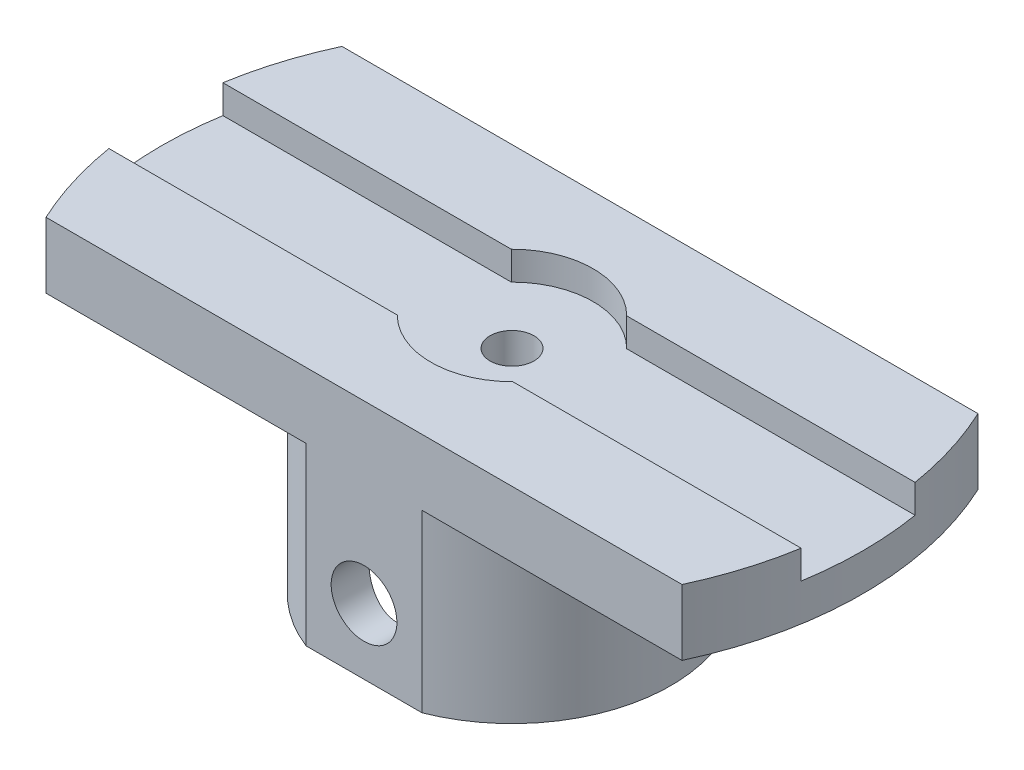
from build123d import *

# Parameters (mm, degrees)
SKETCH1_R               = 16
BOSS_EXTRUDE1_DEPTH     = 3
CUT_EXTRUDE1_START      = -1.3
CUT_EXTRUDE1_DEPTH      = 1.3
CUT_EXTRUDE3_DEPTH      = 2
CUT_EXTRUDE3_DEPTH_BACK = 2
SKETCH4_R               = 1
SKETCH5_R               = 7.25
SKETCH5_R_2             = 5.25
EXTRUDE_THIN1_DEPTH     = 8
CUT_EXTRUDE4_DEPTH      = 100
CUT_EXTRUDE4_DEPTH_BACK = 100
SKETCH6_W               = 10.574311585
SKETCH6_H               = 20.455042326
SKETCH6_W_2             = 9.477353479
SKETCH6_H_2             = 21.35841959
SKETCH7_R               = 1.5
CUT_EXTRUDE5_DEPTH      = 30
SKETCH8_R               = 3.7
CUT_EXTRUDE6_DEPTH      = 1.3


with BuildPart() as part:
    # Sketch1 → Boss-Extrude1 (new body)
    with BuildSketch(Plane(origin=(0, 0, 0), x_dir=(1, 0, 0), z_dir=(0, 1, 0))):
        Circle(SKETCH1_R)
    extrude(amount=BOSS_EXTRUDE1_DEPTH)

    # Sketch2 → Cut-Extrude1 (cut)
    with BuildSketch(Plane(origin=(0, 3, 0), x_dir=(1, 0, 0), z_dir=(0, 1, 0)).offset(CUT_EXTRUDE1_START)):
        with BuildLine():
            Line((-15.787336697, 2.6), (-2.343074903, 2.6))
            ThreePointArc((-2.343074903, 2.6), (0, 3.5), (2.343074903, 2.6))
            Line((2.343074903, 2.6), (15.787336697, 2.6))
            ThreePointArc((15.787336697, 2.6), (16, 0), (15.787336697, -2.6))
            Line((15.787336697, -2.6), (2.343074903, -2.6))
            ThreePointArc((2.343074903, -2.6), (0, -3.5), (-2.343074903, -2.6))
            Line((-2.343074903, -2.6), (-15.787336697, -2.6))
            ThreePointArc((-15.787336697, -2.6), (-16, 0), (-15.787336697, 2.6))
        make_face()
    extrude(amount=CUT_EXTRUDE1_DEPTH, mode=Mode.SUBTRACT)

    # Sketch4 → Cut-Extrude3 (cut, two sides: drawn at the far end of the back side and taken through both)
    with BuildSketch(Plane.XZ.offset(-0.3).offset(-CUT_EXTRUDE3_DEPTH_BACK)):
        Circle(SKETCH4_R)
    extrude(amount=CUT_EXTRUDE3_DEPTH + CUT_EXTRUDE3_DEPTH_BACK, mode=Mode.SUBTRACT)

    # Sketch5 → Extrude-Thin1 (add)
    with BuildSketch(Plane.XZ):
        Circle(SKETCH5_R)
        Circle(SKETCH5_R_2, mode=Mode.SUBTRACT)
    extrude(amount=EXTRUDE_THIN1_DEPTH)

    # Sketch6 → Cut-Extrude4 (cut, two sides: drawn at the far end of the back side and taken through both)
    with BuildSketch(Plane(origin=(0, 0, 0), x_dir=(0, 0, -1), z_dir=(1, 0, 0)).offset(-CUT_EXTRUDE4_DEPTH_BACK)):
        with Locations((-12.037155793, -3.839018001)):
            Rectangle(SKETCH6_W, SKETCH6_H)
        with Locations((11.48867674, -4.290706633)):
            Rectangle(SKETCH6_W_2, SKETCH6_H_2)
    extrude(amount=CUT_EXTRUDE4_DEPTH + CUT_EXTRUDE4_DEPTH_BACK, mode=Mode.SUBTRACT)

    # Sketch7 → Cut-Extrude5 (cut)
    with BuildSketch(Plane(origin=(0, 0, -6.75), x_dir=(-1, 0, 0), z_dir=(0, 0, -1))):
        with Locations((0, -5)):
            Circle(SKETCH7_R)
    extrude(amount=-CUT_EXTRUDE5_DEPTH, mode=Mode.SUBTRACT)

    # Sketch8 → Cut-Extrude6 (cut)
    with BuildSketch(Plane(origin=(0, 3, 0), x_dir=(1, 0, 0), z_dir=(0, 1, 0))):
        Circle(SKETCH8_R)
    extrude(amount=-CUT_EXTRUDE6_DEPTH, mode=Mode.SUBTRACT)


solid = part.part
